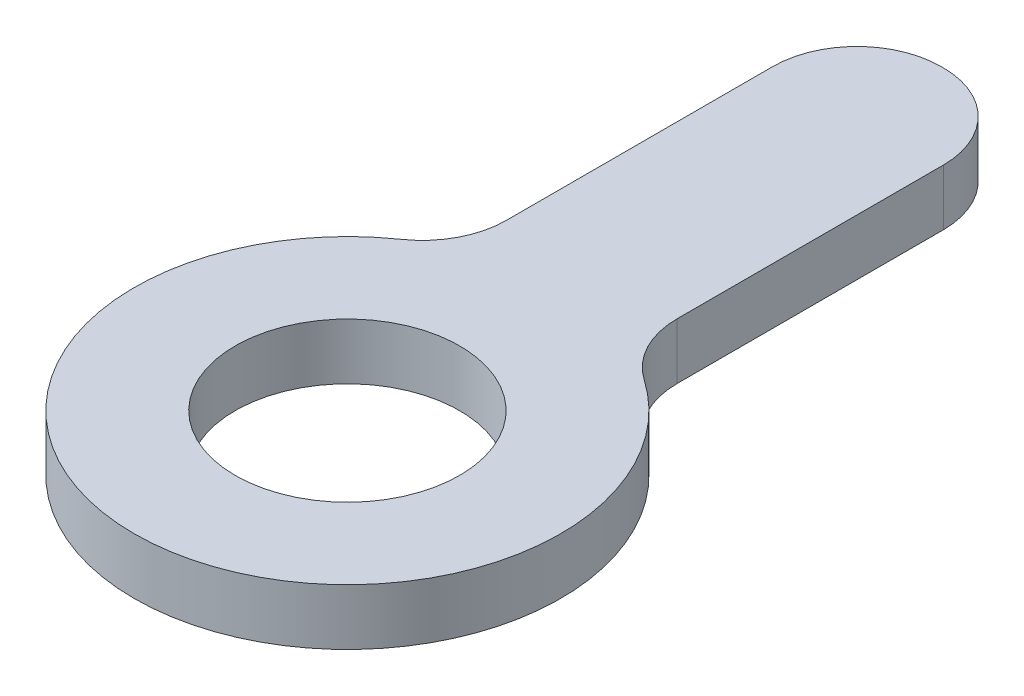
from build123d import *

# Parameters (mm, degrees)
BOSS_EXTRUDE1_DEPTH = 3.175
FILLET1_R           = 4.7625
SKETCH2_R           = 6.35
CUT_EXTRUDE1_DEPTH  = 36.892950213


with BuildPart() as part:
    # Sketch1 → Boss-Extrude1 (new body)
    with BuildSketch(Plane(origin=(0, 0, 0), x_dir=(1, 0, 0), z_dir=(0, 1, 0))):
        with BuildLine():
            ThreePointArc((-4.826, 11.057755152), (0, -12.065), (4.826, 11.057755152))
            Line((4.826, 11.057755152), (4.826, 33.655))
            Line((4.826, 33.655), (-4.826, 33.655))
            Line((-4.826, 33.655), (-4.826, 11.057755152))
        make_face()
    extrude(amount=BOSS_EXTRUDE1_DEPTH)

    # Fillet1
    fillet1_edges = [part.edges().sort_by_distance(p)[0] for p in [
        (4.826, 1.5875, -11.057755152),
        (-4.826, 1.5875, -11.057755152),
        (-4.826, 1.5875, -33.655),
        (4.826, 1.5875, -33.655),
    ]]
    fillet(fillet1_edges, radius=FILLET1_R)

    # Sketch2 → Cut-Extrude1 (cut, through all)
    with BuildSketch(Plane(origin=(0, 3.175, 0), x_dir=(1, 0, 0), z_dir=(0, 1, 0))):
        with Locations(Location((0, 0, 0), (0, 0, 270))):
            Circle(SKETCH2_R)
    extrude(amount=-CUT_EXTRUDE1_DEPTH, mode=Mode.SUBTRACT)


solid = part.part
